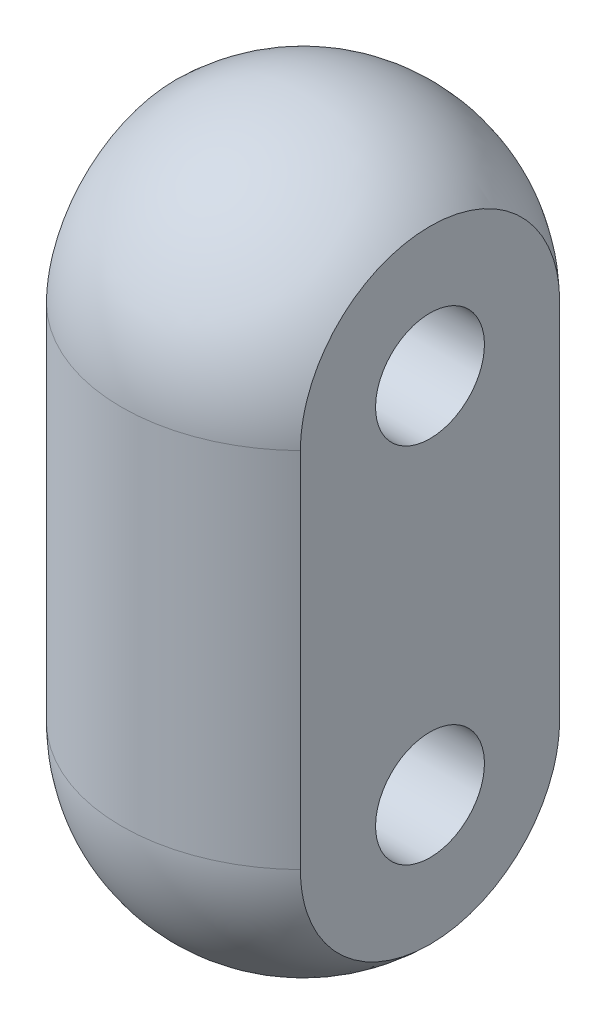
from build123d import *

# Parameters (mm, degrees)
SKETCH_1_R               = 25
EXTRUDE_1_DEPTH          = 100
FILLET_1_R               = 25
CUT_EXTRUDE_2_DEPTH      = 200
CUT_EXTRUDE_2_DEPTH_BACK = 200
SKETCH_2_OUTSIDE_W       = 76.494
SKETCH_2_OUTSIDE_H       = 126.494
SKETCH_2_OUTSIDE_W_2     = 35
SKETCH_2_OUTSIDE_H_2     = 100
SKETCH_3_R               = 7.5
CUT_EXTRUDE_3_DEPTH      = 109.857705285


with BuildPart() as part:
    # 草图1 → 拉伸1 (new body)
    with BuildSketch(Plane(origin=(0, 0, 0), x_dir=(1, 0, 0), z_dir=(0, 1, 0))):
        Circle(SKETCH_1_R)
    extrude(amount=EXTRUDE_1_DEPTH)

    # 圆角1
    fillet_1_edges = [part.edges().sort_by_distance(p)[0] for p in [
        (-25, 0, 0),
        (-25, 100, 0),
    ]]
    fillet(fillet_1_edges, radius=FILLET_1_R)

    # 草图2 outside → 拉伸2 (cut, two sides: drawn at the far end of the back side and taken through both)
    with BuildSketch(Plane.XY.offset(-CUT_EXTRUDE_2_DEPTH_BACK)):
        with Locations((0, 50)):
            Rectangle(SKETCH_2_OUTSIDE_W, SKETCH_2_OUTSIDE_H)
        with Locations((0, 50)):
            Rectangle(SKETCH_2_OUTSIDE_W_2, SKETCH_2_OUTSIDE_H_2, mode=Mode.SUBTRACT)
    extrude(amount=CUT_EXTRUDE_2_DEPTH + CUT_EXTRUDE_2_DEPTH_BACK, mode=Mode.SUBTRACT)

    # 草图3 → 拉伸3 (cut, through all)
    with BuildSketch(Plane.ZY.offset(17.5)):
        with Locations((0, 75)):
            Circle(SKETCH_3_R)
        with Locations((0, 25)):
            Circle(SKETCH_3_R)
    extrude(amount=-CUT_EXTRUDE_3_DEPTH, mode=Mode.SUBTRACT)


solid = part.part
